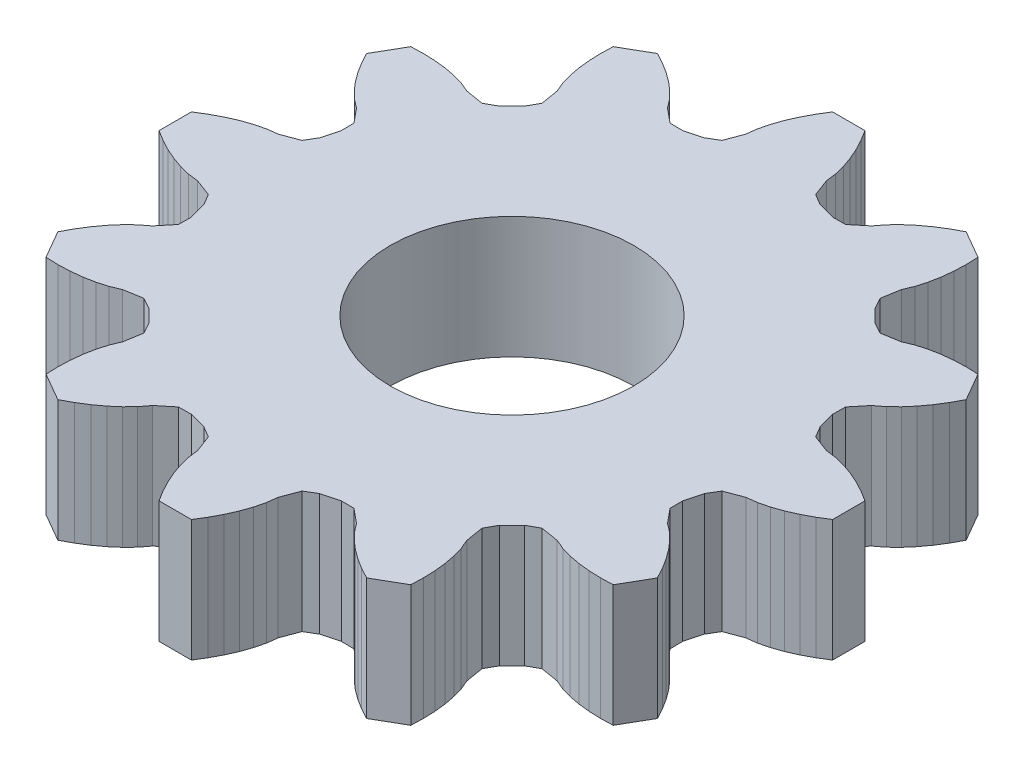
from build123d import *

# Parameters (mm, degrees)
SKETCH_1_R      = 4
EXTRUDE_1_DEPTH = 4


with BuildPart() as part:
    # Эскиз1 → Бобышка-Вытянуть1 (new body)
    with BuildSketch(Plane(origin=(0, 0, 0), x_dir=(1, 0, 0), z_dir=(0, 1, 0))):
        Polygon((8.22218819, 1.89977705), (8.436252749, 1.539508649), (9.006348547, 1.326067058), (9.344791391, 1.283132513), (9.687734769, 1.197769899), (10.032859113, 1.077224911), (10.378431206, 0.924756352), (10.722916022, 0.742245913), (11.064869104, 0.530935423), (11.064869104, -0.530935423), (10.722916022, -0.742245913), (10.378431206, -0.924756352), (10.032859113, -1.077224911), (9.687734769, -1.197769899), (9.344791391, -1.283132513), (9.006348547, -1.326067058), (8.436252749, -1.539508649), (8.22218819, -1.89977705), (8.070512373, -2.465838908), (8.075763518, -2.884872775), (8.462760166, -3.354766514), (8.734392995, -3.561170343), (8.988709365, -3.806568224), (9.22732332, -4.083525419), (9.450363252, -4.38835311), (9.657440634, -4.718654194), (9.847925445, -5.072630987), (9.316990021, -5.992238116), (8.915194721, -6.004261827), (8.525606899, -5.990078096), (8.15009841, -5.949333695), (7.790939466, -5.881166545), (7.451260481, -5.783621049), (7.136693108, -5.651582033), (6.536254869, -5.551379974), (6.170735323, -5.756349282), (5.756349282, -6.170735323), (5.551379974, -6.536254869), (5.651582033, -7.136693108), (5.783621049, -7.451260481), (5.881166545, -7.790939466), (5.949333695, -8.15009841), (5.990078096, -8.525606899), (6.004261827, -8.915194721), (5.992238116, -9.316990021), (5.072630987, -9.847925445), (4.718654194, -9.657440634), (4.38835311, -9.450363252), (4.083525419, -9.22732332), (3.806568224, -8.988709365), (3.561170343, -8.734392995), (3.354766514, -8.462760166), (2.884872775, -8.075763518), (2.465838908, -8.070512373), (1.89977705, -8.22218819), (1.539508649, -8.436252749), (1.326067058, -9.006348547), (1.283132513, -9.344791391), (1.197769899, -9.687734769), (1.077224911, -10.032859113), (0.924756352, -10.378431206), (0.742245913, -10.722916022), (0.530935423, -11.064869104), (-0.530935423, -11.064869104), (-0.742245913, -10.722916022), (-0.924756352, -10.378431206), (-1.077224911, -10.032859113), (-1.197769899, -9.687734769), (-1.283132513, -9.344791391), (-1.326067058, -9.006348547), (-1.539508649, -8.436252749), (-1.89977705, -8.22218819), (-2.465838908, -8.070512373), (-2.884872775, -8.075763518), (-3.354766514, -8.462760166), (-3.561170343, -8.734392995), (-3.806568224, -8.988709365), (-4.083525419, -9.22732332), (-4.38835311, -9.450363252), (-4.718654194, -9.657440634), (-5.072630987, -9.847925445), (-5.992238116, -9.316990021), (-6.004261827, -8.915194721), (-5.990078096, -8.525606899), (-5.949333695, -8.15009841), (-5.881166545, -7.790939466), (-5.783621049, -7.451260481), (-5.651582033, -7.136693108), (-5.551379974, -6.536254869), (-5.756349282, -6.170735323), (-6.170735323, -5.756349282), (-6.536254869, -5.551379974), (-7.136693108, -5.651582033), (-7.451260481, -5.783621049), (-7.790939466, -5.881166545), (-8.15009841, -5.949333695), (-8.525606899, -5.990078096), (-8.915194721, -6.004261827), (-9.316990021, -5.992238116), (-9.847925445, -5.072630987), (-9.657440634, -4.718654194), (-9.450363252, -4.38835311), (-9.22732332, -4.083525419), (-8.988709365, -3.806568224), (-8.734392995, -3.561170343), (-8.462760166, -3.354766514), (-8.075763518, -2.884872775), (-8.070512373, -2.465838908), (-8.22218819, -1.89977705), (-8.436252749, -1.539508649), (-9.006348547, -1.326067058), (-9.344791391, -1.283132513), (-9.687734769, -1.197769899), (-10.032859113, -1.077224911), (-10.378431206, -0.924756352), (-10.722916022, -0.742245913), (-11.064869104, -0.530935423), (-11.064869104, 0.530935423), (-10.722916022, 0.742245913), (-10.378431206, 0.924756352), (-10.032859113, 1.077224911), (-9.687734769, 1.197769899), (-9.344791391, 1.283132513), (-9.006348547, 1.326067058), (-8.436252749, 1.539508649), (-8.22218819, 1.89977705), (-8.070512373, 2.465838908), (-8.075763518, 2.884872775), (-8.462760166, 3.354766514), (-8.734392995, 3.561170343), (-8.988709365, 3.806568224), (-9.22732332, 4.083525419), (-9.450363252, 4.38835311), (-9.657440634, 4.718654194), (-9.847925445, 5.072630987), (-9.316990021, 5.992238116), (-8.915194721, 6.004261827), (-8.525606899, 5.990078096), (-8.15009841, 5.949333695), (-7.790939466, 5.881166545), (-7.451260481, 5.783621049), (-7.136693108, 5.651582033), (-6.536254869, 5.551379974), (-6.170735323, 5.756349282), (-5.756349282, 6.170735323), (-5.551379974, 6.536254869), (-5.651582033, 7.136693108), (-5.783621049, 7.451260481), (-5.881166545, 7.790939466), (-5.949333695, 8.15009841), (-5.990078096, 8.525606899), (-6.004261827, 8.915194721), (-5.992238116, 9.316990021), (-5.072630987, 9.847925445), (-4.718654194, 9.657440634), (-4.38835311, 9.450363252), (-4.083525419, 9.22732332), (-3.806568224, 8.988709365), (-3.561170343, 8.734392995), (-3.354766514, 8.462760166), (-2.884872775, 8.075763518), (-2.465838908, 8.070512373), (-1.89977705, 8.22218819), (-1.539508649, 8.436252749), (-1.326067058, 9.006348547), (-1.283132513, 9.344791391), (-1.197769899, 9.687734769), (-1.077224911, 10.032859113), (-0.924756352, 10.378431206), (-0.742245913, 10.722916022), (-0.530935423, 11.064869104), (0.530935423, 11.064869104), (0.742245913, 10.722916022), (0.924756352, 10.378431206), (1.077224911, 10.032859113), (1.197769899, 9.687734769), (1.283132513, 9.344791391), (1.326067058, 9.006348547), (1.539508649, 8.436252749), (1.89977705, 8.22218819), (2.465838908, 8.070512373), (2.884872775, 8.075763518), (3.354766514, 8.462760166), (3.561170343, 8.734392995), (3.806568224, 8.988709365), (4.083525419, 9.22732332), (4.38835311, 9.450363252), (4.718654194, 9.657440634), (5.072630987, 9.847925445), (5.992238116, 9.316990021), (6.004261827, 8.915194721), (5.990078096, 8.525606899), (5.949333695, 8.15009841), (5.881166545, 7.790939466), (5.783621049, 7.451260481), (5.651582033, 7.136693108), (5.551379974, 6.536254869), (5.756349282, 6.170735323), (6.170735323, 5.756349282), (6.536254869, 5.551379974), (7.136693108, 5.651582033), (7.451260481, 5.783621049), (7.790939466, 5.881166545), (8.15009841, 5.949333695), (8.525606899, 5.990078096), (8.915194721, 6.004261827), (9.316990021, 5.992238116), (9.847925445, 5.072630987), (9.657440634, 4.718654194), (9.450363252, 4.38835311), (9.22732332, 4.083525419), (8.988709365, 3.806568224), (8.734392995, 3.561170343), (8.462760166, 3.354766514), (8.075763518, 2.884872775), (8.070512373, 2.465838908), align=None)
        with Locations(Location((0, 0, 0), (0, 0, 270))):
            Circle(SKETCH_1_R, mode=Mode.SUBTRACT)
    extrude(amount=EXTRUDE_1_DEPTH)


solid = part.part
